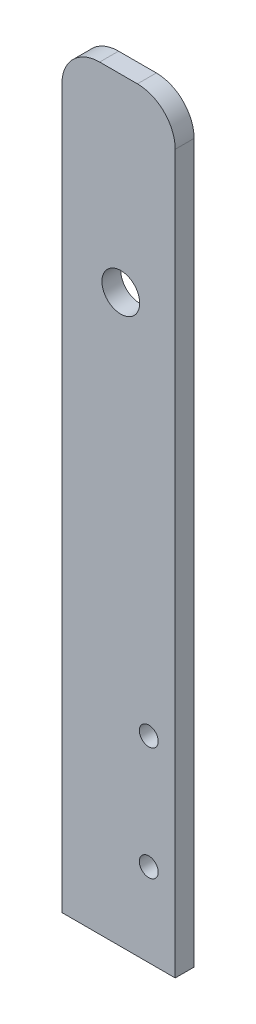
from build123d import *

# Parameters (mm, degrees)
SKETCH2_W           = 38.1
SKETCH2_H           = 254
BOSS_EXTRUDE1_DEPTH = 6.35
SIDE_EDGE_R         = 12.7
SIDE_EDGE_2_R       = 12.7
SKETCH4_R           = 3.175
SKETCH4_R_2         = 6.35
CUT_EXTRUDE1_DEPTH  = 257.920089717


with BuildPart() as part:
    # Sketch2 → Boss-Extrude1 (new body)
    with BuildSketch(Plane.XY):
        with Locations((19.05, 127)):
            Rectangle(SKETCH2_W, SKETCH2_H)
    extrude(amount=BOSS_EXTRUDE1_DEPTH)

    # Side Edge
    side_edge_edges = [part.edges().sort_by_distance(p)[0] for p in [
        (38.1, 254, 3.175),
    ]]
    fillet(side_edge_edges, radius=SIDE_EDGE_R)

    # Side Edge 2
    side_edge_2_edges = [part.edges().sort_by_distance(p)[0] for p in [
        (0, 254, 3.175),
    ]]
    fillet(side_edge_2_edges, radius=SIDE_EDGE_2_R)

    # Sketch4 → Cut-Extrude1 (cut, through all)
    with BuildSketch(Plane.XY.offset(6.35)):
        with Locations((29.21, 27.94)):
            Circle(SKETCH4_R)
        with Locations((29.21, 66.04)):
            Circle(SKETCH4_R)
        with Locations((19.812, 190.5)):
            Circle(SKETCH4_R_2)
    extrude(amount=-CUT_EXTRUDE1_DEPTH, mode=Mode.SUBTRACT)


solid = part.part
